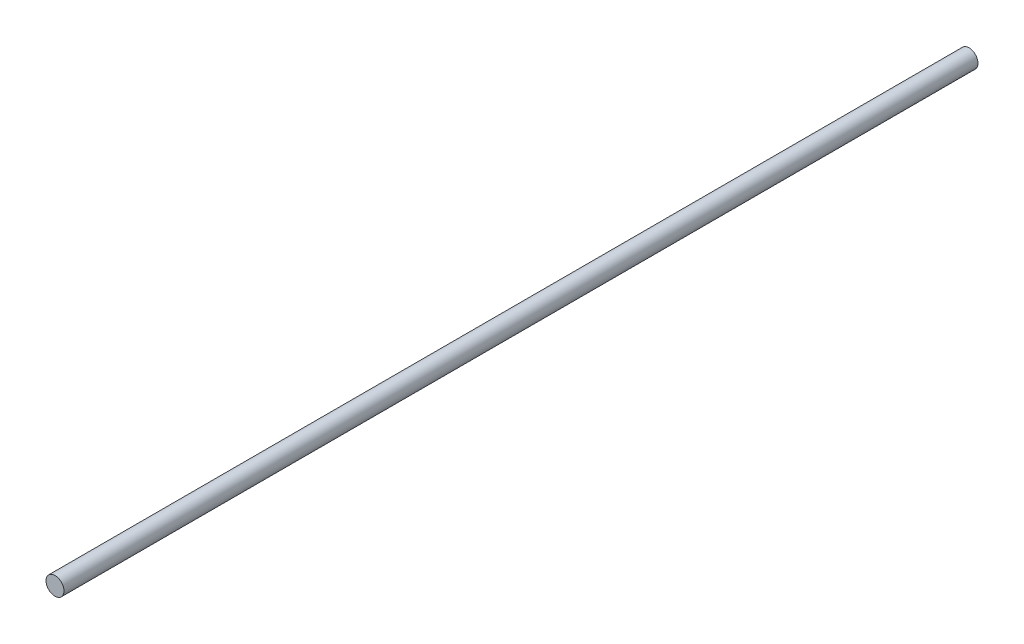
from build123d import *

# Parameters (mm, degrees)
SKETCH1_R           = 6
BOSS_EXTRUDE1_DEPTH = 610


with BuildPart() as part:
    # Sketch1 → Boss-Extrude1 (new body)
    with BuildSketch(Plane.XY.offset(5)):
        with Locations((1299.872841024, 107.130737771)):
            Circle(SKETCH1_R)
    extrude(amount=-BOSS_EXTRUDE1_DEPTH)


solid = part.part
